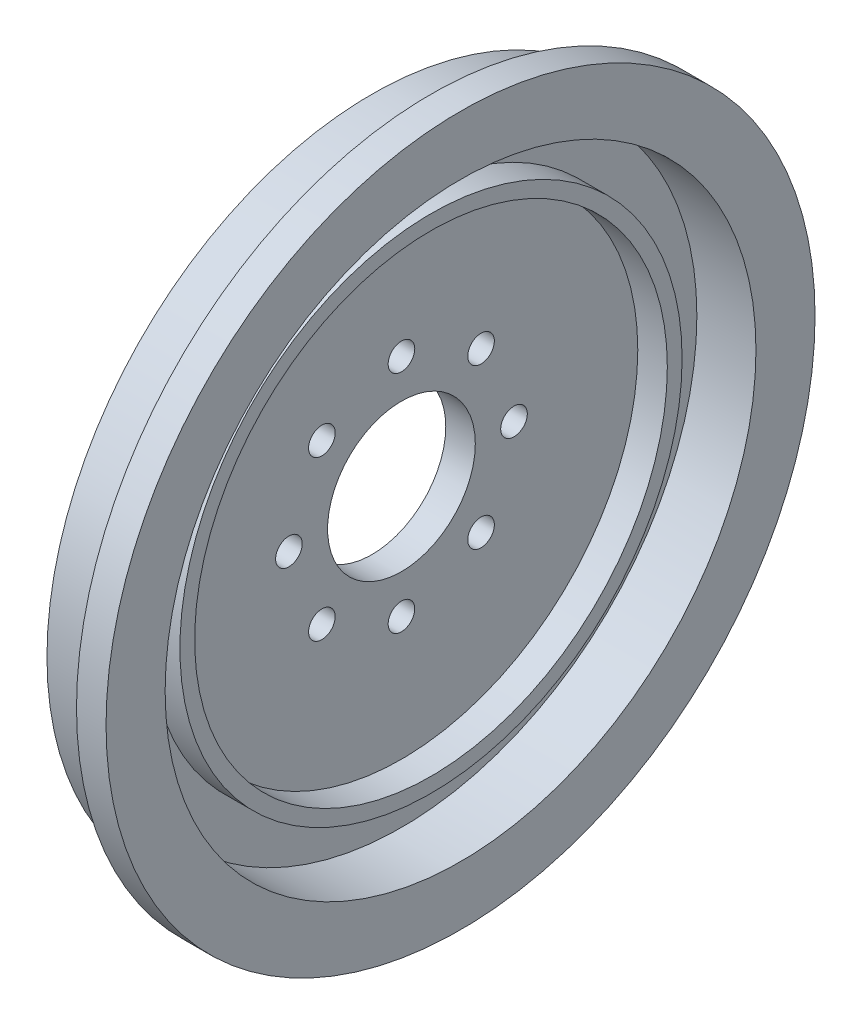
from build123d import *

# Parameters (mm, degrees)
SZKIC1_R                    = 120
DODANIE_WYCI_GNI_CIE1_DEPTH = 30
SZKIC2_R                    = 100
WYTNIJ_WYCI_GNI_CIE1_DEPTH  = 20
SZKIC3_R                    = 4.5
WYTNIJ_WYCI_GNI_CIE2_DEPTH  = 171.880074906
SZKIC4_R                    = 25
WYTNIJ_WYCI_GNI_CIE3_DEPTH  = 171.880074906
SZKIC5_R                    = 85
SZKIC5_R_2                  = 80
DODANIE_WYCI_GNI_CIE2_DEPTH = 10
WYTNIJ_WYCI_GNI_CIE4_START  = -30
SZKIC6_R                    = 120
SZKIC6_R_2                  = 110
WYTNIJ_WYCI_GNI_CIE4_DEPTH  = 20


with BuildPart() as part:
    # Szkic1 → Dodanie-wyciągnięcie1 (new body)
    with BuildSketch(Plane(origin=(0, 0, 0), x_dir=(0, 0, -1), z_dir=(1, 0, 0))):
        Circle(SZKIC1_R)
    extrude(amount=DODANIE_WYCI_GNI_CIE1_DEPTH)

    # Szkic2 → Wytnij-wyciągnięcie1 (cut)
    with BuildSketch(Plane(origin=(30, 0, 0), x_dir=(0, 0, -1), z_dir=(1, 0, 0))):
        Circle(SZKIC2_R)
    extrude(amount=-WYTNIJ_WYCI_GNI_CIE1_DEPTH, mode=Mode.SUBTRACT)

    # Szkic3 → Wytnij-wyciągnięcie2 (cut, through all)
    with BuildSketch(Plane(origin=(10, 0, 0), x_dir=(0, 0, -1), z_dir=(1, 0, 0))):
        with Locations((0, 38.1)):
            Circle(SZKIC3_R)
        with Locations((26.940768363, 26.940768363)):
            Circle(SZKIC3_R)
        with Locations((38.1, 0)):
            Circle(SZKIC3_R)
        with Locations((26.940768363, -26.940768363)):
            Circle(SZKIC3_R)
        with Locations((0, -38.1)):
            Circle(SZKIC3_R)
        with Locations((-26.940768363, -26.940768363)):
            Circle(SZKIC3_R)
        with Locations((-38.1, 0)):
            Circle(SZKIC3_R)
        with Locations((-26.940768363, 26.940768363)):
            Circle(SZKIC3_R)
    extrude(amount=-WYTNIJ_WYCI_GNI_CIE2_DEPTH, mode=Mode.SUBTRACT)

    # Szkic4 → Wytnij-wyciągnięcie3 (cut, through all)
    with BuildSketch(Plane(origin=(10, 0, 0), x_dir=(0, 0, -1), z_dir=(1, 0, 0))):
        Circle(SZKIC4_R)
    extrude(amount=-WYTNIJ_WYCI_GNI_CIE3_DEPTH, mode=Mode.SUBTRACT)

    # Szkic5 → Dodanie-wyciągnięcie2 (add)
    with BuildSketch(Plane(origin=(10, 0, 0), x_dir=(0, 0, -1), z_dir=(1, 0, 0))):
        Circle(SZKIC5_R)
        Circle(SZKIC5_R_2, mode=Mode.SUBTRACT)
    extrude(amount=DODANIE_WYCI_GNI_CIE2_DEPTH)

    # Szkic6 → Wytnij-wyciągnięcie4 (cut)
    with BuildSketch(Plane(origin=(30, 0, 0), x_dir=(0, 0, -1), z_dir=(1, 0, 0)).offset(WYTNIJ_WYCI_GNI_CIE4_START)):
        Circle(SZKIC6_R)
        Circle(SZKIC6_R_2, mode=Mode.SUBTRACT)
    extrude(amount=WYTNIJ_WYCI_GNI_CIE4_DEPTH, mode=Mode.SUBTRACT)


solid = part.part
